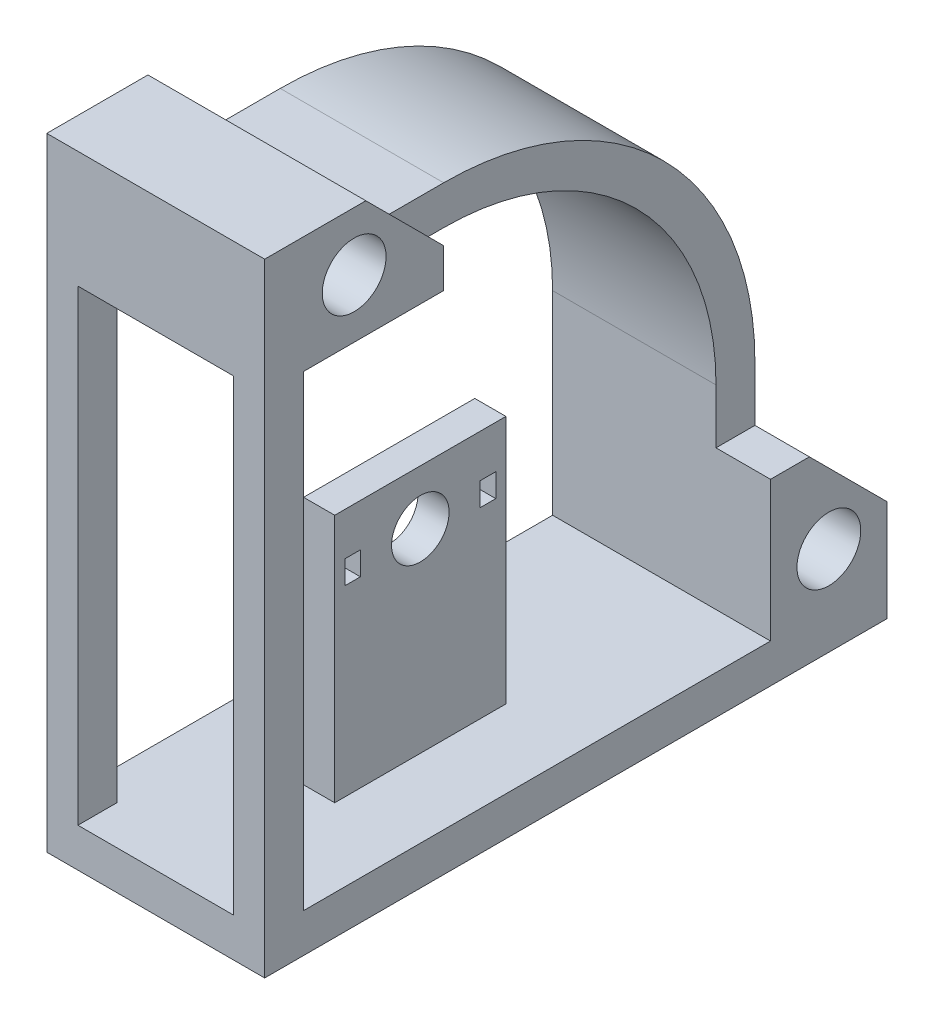
from build123d import *

# Parameters (mm, degrees)
BOSS_EXTRUDE1_DEPTH = 28
BOSS_EXTRUDE2_START = -10
SKETCH3_W           = 22
SKETCH3_H           = 32
SKETCH3_R           = 3.7
SKETCH3_W_2         = 2
SKETCH3_H_2         = 3
BOSS_EXTRUDE2_DEPTH = 4
CUT_EXTRUDE1_START  = -7
CUT_EXTRUDE1_DEPTH  = 7
CHAMFER1_SIZE       = 10
CHAMFER1_SIZE2      = 5.773502692
CUT_EXTRUDE2_REACH  = 87.346
SKETCH5_W           = 20
SKETCH5_H           = 60
SKETCH6_W           = 23
SKETCH6_H           = 10
SKETCH6_W_2         = 10
SKETCH6_H_2         = 23
BOSS_EXTRUDE3_DEPTH = 28
SKETCH8_R           = 4.1
CUT_EXTRUDE3_DEPTH  = 77.052613367
CHAMFER2_SIZE       = 10


with BuildPart() as part:
    # Sketch2 → Boss-Extrude1 (new body)
    with BuildSketch(Plane(origin=(0, 0, 0), x_dir=(0, 0, -1), z_dir=(1, 0, 0))):
        with BuildLine():
            Line((0, 40), (-30, 40))
            Line((-30, 40), (-30, -30))
            Line((-30, -30), (40, -30))
            Line((40, -30), (40, 0))
            ThreePointArc((40, 0), (28.284271247, 28.284271247), (0, 40))
        make_face()
        with BuildLine():
            Line((-25, 35), (-25, -25))
            Line((-25, -25), (35, -25))
            Line((35, -25), (35, 0))
            ThreePointArc((35, 0), (24.748737342, 24.748737342), (0, 35))
            Line((0, 35), (-25, 35))
        make_face(mode=Mode.SUBTRACT)
    extrude(amount=BOSS_EXTRUDE1_DEPTH)

    # Sketch3 → Boss-Extrude2 (add)
    with BuildSketch(Plane(origin=(28, 0, 0), x_dir=(0, 0, -1), z_dir=(1, 0, 0)).offset(BOSS_EXTRUDE2_START)):
        with Locations((0, -9)):
            Rectangle(SKETCH3_W, SKETCH3_H)
        Circle(SKETCH3_R, mode=Mode.SUBTRACT)
        with Locations((-8.7, 0)):
            Rectangle(SKETCH3_W_2, SKETCH3_H_2, mode=Mode.SUBTRACT)
        with Locations((8.7, 0)):
            Rectangle(SKETCH3_W_2, SKETCH3_H_2, mode=Mode.SUBTRACT)
    extrude(amount=-BOSS_EXTRUDE2_DEPTH)

    # Sketch4 → Cut-Extrude1 (cut)
    with BuildSketch(Plane(origin=(28, 0, 0), x_dir=(0, 0, -1), z_dir=(1, 0, 0)).offset(CUT_EXTRUDE1_START)):
        with BuildLine():
            Line((0, 40), (-7, 40))
            Line((-7, 40), (-7, 35))
            Line((-7, 35), (0, 35))
            ThreePointArc((0, 35), (24.748737342, 24.748737342), (35, 0))
            Line((35, 0), (35, -7))
            Line((35, -7), (40, -7))
            Line((40, -7), (40, 0))
            ThreePointArc((40, 0), (28.284271247, 28.284271247), (0, 40))
        make_face()
    extrude(amount=CUT_EXTRUDE1_DEPTH, mode=Mode.SUBTRACT)

    # Chamfer1
    chamfer1_edges = [part.edges().sort_by_distance(p)[0] for p in [
        (14, -25, 0),
    ]]
    chamfer1_side = [part.faces().sort_by_distance(p)[0] for p in [
        (14, -9.762838276, 0),
    ]]
    chamfer(chamfer1_edges, length=CHAMFER1_SIZE, length2=CHAMFER1_SIZE2, reference=chamfer1_side[0])

    # Sketch5 → Cut-Extrude2 (cut, up to next)
    with BuildSketch(Plane.XY.offset(30), mode=Mode.PRIVATE) as cut_extrude2_sk1:
        with Locations((14, 5)):
            Rectangle(SKETCH5_W, SKETCH5_H)
    cut_extrude2_tool1 = extrude(cut_extrude2_sk1.sketch, amount=-CUT_EXTRUDE2_REACH, mode=Mode.PRIVATE) & part.part
    add(cut_extrude2_tool1.solids().sort_by_distance((14, 5, 30))[0], mode=Mode.SUBTRACT)

    # Sketch6 → Boss-Extrude3 (add)
    with BuildSketch(Plane(origin=(28, 0, 0), x_dir=(0, 0, -1), z_dir=(1, 0, 0))):
        with Locations((-18.5, 45)):
            Rectangle(SKETCH6_W, SKETCH6_H)
        with Locations((45, -18.5)):
            Rectangle(SKETCH6_W_2, SKETCH6_H_2)
    extrude(amount=-BOSS_EXTRUDE3_DEPTH)

    # Sketch8 → Cut-Extrude3 (cut, through all)
    with BuildSketch(Plane(origin=(28, 0, 0), x_dir=(0, 0, -1), z_dir=(1, 0, 0))):
        with Locations((-18.5, 42.5)):
            Circle(SKETCH8_R)
        with Locations((42.5, -18.5)):
            Circle(SKETCH8_R)
    extrude(amount=-CUT_EXTRUDE3_DEPTH, mode=Mode.SUBTRACT)

    # Chamfer2
    chamfer2_edges = [part.edges().sort_by_distance(p)[0] for p in [
        (14, -7, -50),
        (14, 50, 7),
    ]]
    chamfer(chamfer2_edges, length=CHAMFER2_SIZE)


solid = part.part
